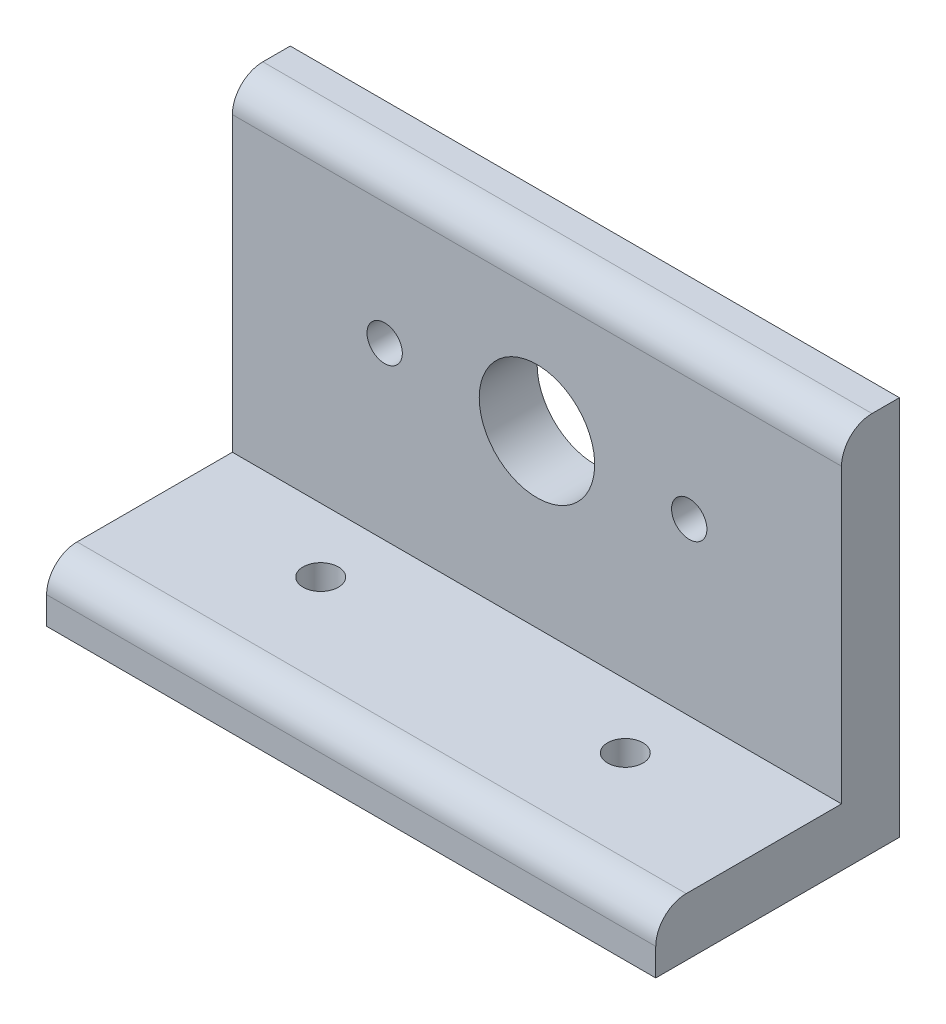
from build123d import *

# Parameters (mm, degrees)
SKETCH1_W           = 50.8
SKETCH1_H           = 20.32
SKETCH1_R           = 1.4732
BOSS_EXTRUDE1_DEPTH = 4.826
SKETCH2_W           = 50.8
SKETCH2_H           = 4.826
BOSS_EXTRUDE2_DEPTH = 26.924
FILLET1_R           = 2.54
SKETCH3_R           = 1.4732
SKETCH3_R_2         = 4.8133
CUT_EXTRUDE1_DEPTH  = 26.924


with BuildPart() as part:
    # Sketch1 → Boss-Extrude1 (new body)
    with BuildSketch(Plane(origin=(0, 0, 0), x_dir=(1, 0, 0), z_dir=(0, 1, 0))):
        with Locations((25.4, 10.16)):
            Rectangle(SKETCH1_W, SKETCH1_H)
        with Locations(Location((12.7, 10.16, 0), (0, 0, 270))):
            Circle(SKETCH1_R, mode=Mode.SUBTRACT)
        with Locations(Location((38.1, 10.16, 0), (0, 0, 270))):
            Circle(SKETCH1_R, mode=Mode.SUBTRACT)
    extrude(amount=BOSS_EXTRUDE1_DEPTH)

    # Sketch2 → Boss-Extrude2 (add)
    with BuildSketch(Plane(origin=(0, 4.826, 0), x_dir=(1, 0, 0), z_dir=(0, 1, 0))):
        with Locations((25.4, 17.907)):
            Rectangle(SKETCH2_W, SKETCH2_H)
    extrude(amount=BOSS_EXTRUDE2_DEPTH)

    # Fillet1
    fillet1_edges = [part.edges().sort_by_distance(p)[0] for p in [
        (25.4, 31.75, -15.494),
        (25.4, 4.826, 0),
    ]]
    fillet(fillet1_edges, radius=FILLET1_R)

    # Sketch3 → Cut-Extrude1 (cut)
    with BuildSketch(Plane(origin=(0, 0, -20.32), x_dir=(-1, 0, 0), z_dir=(0, 0, -1))):
        with Locations((-38.1, 19.05)):
            Circle(SKETCH3_R)
        with Locations((-12.7, 19.05)):
            Circle(SKETCH3_R)
        with Locations((-25.4, 19.05)):
            Circle(SKETCH3_R_2)
    extrude(amount=-CUT_EXTRUDE1_DEPTH, mode=Mode.SUBTRACT)


solid = part.part
